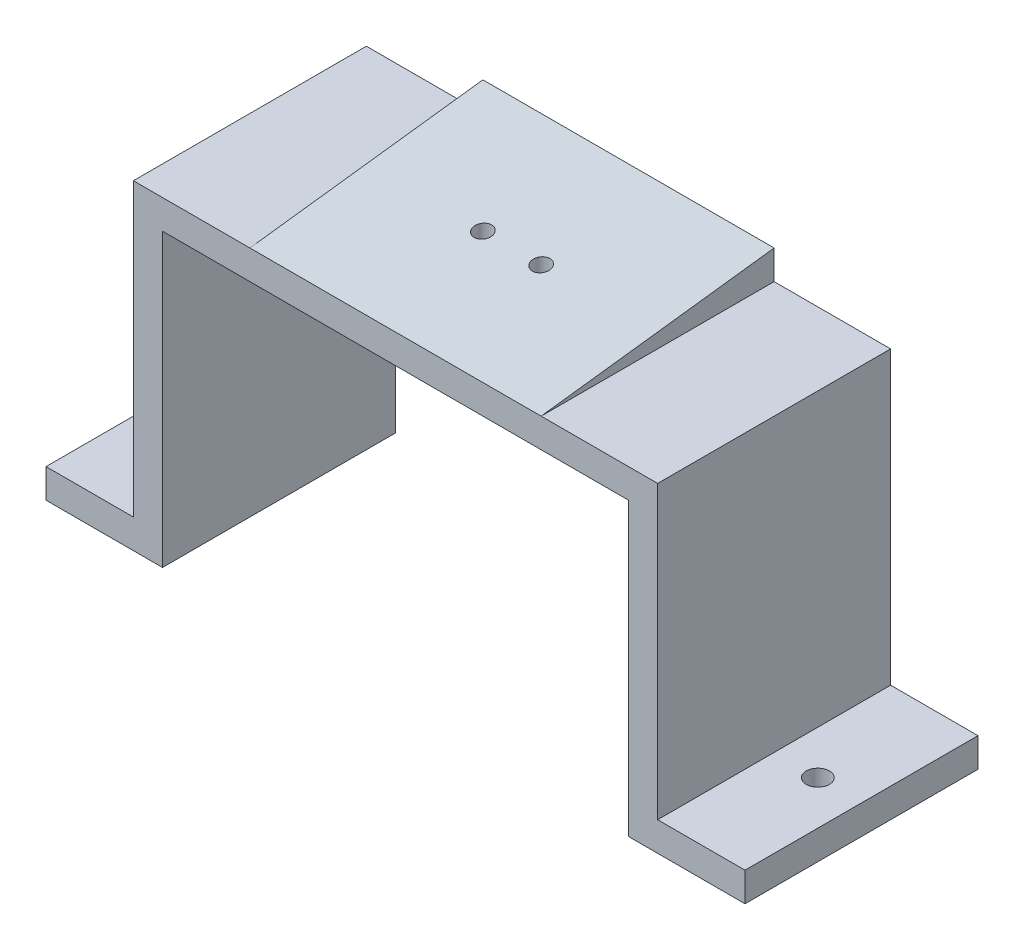
from build123d import *

# Parameters (mm, degrees)
SKETCH1_W           = 50
SKETCH1_H           = 40
SKETCH1_R           = 1.5
BOSS_EXTRUDE1_DEPTH = 10
CUT_EXTRUDE2_DEPTH  = 50
SKETCH4_W           = 39.996802558
SKETCH4_H           = 5
BOSS_EXTRUDE2_DEPTH = 20
SKETCH5_W           = 5
SKETCH5_H           = 39.996802558
BOSS_EXTRUDE3_DEPTH = 50
SKETCH6_W           = 39.996802558
SKETCH6_H           = 5
BOSS_EXTRUDE4_DEPTH = 15
SKETCH9_R           = 2
CUT_EXTRUDE6_DEPTH  = 5


with BuildPart() as part:
    # Sketch1 → Boss-Extrude1 (new body)
    with BuildSketch(Plane(origin=(0, 0, 0), x_dir=(1, 0, 0), z_dir=(0, 1, 0))):
        Rectangle(SKETCH1_W, SKETCH1_H)
        with Locations(Location((5, 0, 0), (0, 0, 270))):
            Circle(SKETCH1_R, mode=Mode.SUBTRACT)
        with Locations(Location((-5, 0, 0), (0, 0, 90))):
            Circle(SKETCH1_R, mode=Mode.SUBTRACT)
    extrude(amount=BOSS_EXTRUDE1_DEPTH)

    # Sketch3 → Cut-Extrude2 (cut)
    with BuildSketch(Plane.ZY.offset(25)):
        Polygon((-20, 10), (20, 5), (20, 10), align=None)
        Polygon((20, 0), (-20, 5), (-20, 0), align=None)
    extrude(amount=-CUT_EXTRUDE2_DEPTH, mode=Mode.SUBTRACT)

    # Sketch4 → Boss-Extrude2 (add)
    with BuildSketch(Plane.ZY.offset(25)):
        with Locations((0.001598721, 2.5)):
            Rectangle(SKETCH4_W, SKETCH4_H)
    boss_extrude2 = extrude(amount=BOSS_EXTRUDE2_DEPTH)

    # Sketch5 → Boss-Extrude3 (add)
    with BuildSketch(Plane.XZ):
        with Locations((-42.5, 0.001598721)):
            Rectangle(SKETCH5_W, SKETCH5_H)
    boss_extrude3 = extrude(amount=BOSS_EXTRUDE3_DEPTH)

    # Sketch6 → Boss-Extrude4 (add)
    with BuildSketch(Plane.ZY.offset(45)):
        with Locations((0.001598721, -47.5)):
            Rectangle(SKETCH6_W, SKETCH6_H)
    boss_extrude4 = extrude(amount=BOSS_EXTRUDE4_DEPTH)

    # Sketch9 → Cut-Extrude6 (cut)
    with BuildSketch(Plane(origin=(0, -45, 0), x_dir=(1, 0, 0), z_dir=(0, 1, 0))):
        with Locations(Location((-52.5, -0.001598721, 0), (0, 0, 270))):
            Circle(SKETCH9_R)
    cut_extrude6 = extrude(amount=-CUT_EXTRUDE6_DEPTH, mode=Mode.SUBTRACT)

    # Mirror3: Boss-Extrude2, Boss-Extrude3, Boss-Extrude4, Cut-Extrude6 across plane
    add(boss_extrude2.mirror(Plane(origin=(0, 0, 0), x_dir=(0, 0, 1), z_dir=(1, 0, 0))))
    add(boss_extrude3.mirror(Plane(origin=(0, 0, 0), x_dir=(0, 0, 1), z_dir=(1, 0, 0))))
    add(boss_extrude4.mirror(Plane(origin=(0, 0, 0), x_dir=(0, 0, 1), z_dir=(1, 0, 0))))
    add(cut_extrude6.mirror(Plane(origin=(0, 0, 0), x_dir=(0, 0, 1), z_dir=(1, 0, 0))), mode=Mode.SUBTRACT)


solid = part.part
